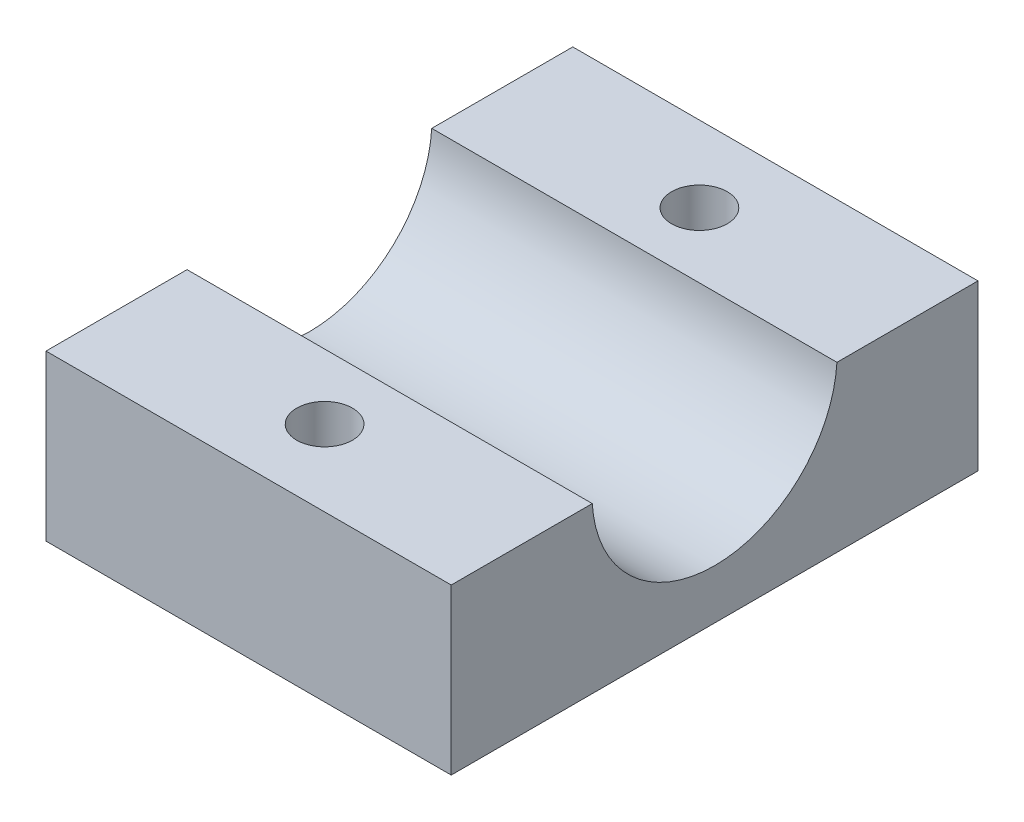
from build123d import *

# Parameters (mm, degrees)
SKETCH1_W                     = 52
SKETCH1_H                     = 16.25
CLAMP_LOWER_HALF_DEPTH        = 20
HANDLEBAR_BORE_DEPTH          = 44.783558558
HANDLEBAR_BORE_DEPTH_BACK     = 44.783558558
SKETCH2_R                     = 12.1
M5_CLEARANCE_HOLES_DEPTH      = 44.783558558
M5_CLEARANCE_HOLES_DEPTH_BACK = 44.783558558
SKETCH3_R                     = 2.75


with BuildPart() as part:
    # Sketch1 → Clamp Lower Half (new, symmetric)
    with BuildSketch(Plane(origin=(0, 0, 0), x_dir=(0, 0, -1), z_dir=(1, 0, 0))):
        with Locations((0, -20.875)):
            Rectangle(SKETCH1_W, SKETCH1_H)
    extrude(amount=CLAMP_LOWER_HALF_DEPTH, both=True)

    # Sketch2 → Handlebar Bore (cut, two sides: drawn at the far end of the back side and taken through both)
    with BuildSketch(Plane(origin=(0, 0, 0), x_dir=(0, 0, -1), z_dir=(1, 0, 0)).offset(-HANDLEBAR_BORE_DEPTH_BACK)):
        with Locations((0, -12)):
            Circle(SKETCH2_R)
    extrude(amount=HANDLEBAR_BORE_DEPTH + HANDLEBAR_BORE_DEPTH_BACK, mode=Mode.SUBTRACT)

    # Sketch3 → M5 Clearance Holes (cut, two sides: drawn at the far end of the back side and taken through both)
    with BuildSketch(Plane(origin=(0, 0, 0), x_dir=(1, 0, 0), z_dir=(0, 1, 0)).offset(-M5_CLEARANCE_HOLES_DEPTH_BACK)):
        with Locations(Location((0, -18.5, 0), (0, 0, 270))):
            Circle(SKETCH3_R)
        with Locations(Location((0, 18.5, 0), (0, 0, 270))):
            Circle(SKETCH3_R)
    extrude(amount=M5_CLEARANCE_HOLES_DEPTH + M5_CLEARANCE_HOLES_DEPTH_BACK, mode=Mode.SUBTRACT)


solid = part.part
